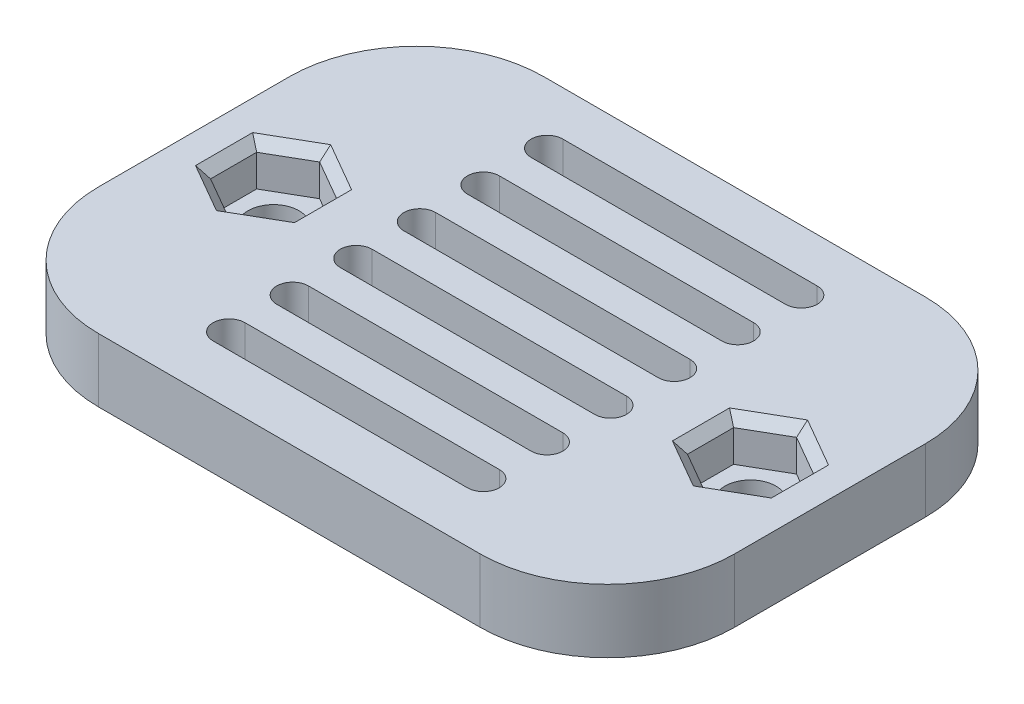
from build123d import *

# Parameters (mm, degrees)
CROQUIS1_W                 = 100
CROQUIS1_H                 = 70
SALIENTE_EXTRUIR1_DEPTH    = 10
CORTAR_EXTRUIR1_DEPTH      = 6.5
CROQUIS5_R                 = 4
CORTAR_EXTRUIR2_DEPTH      = 10
CHAFL_N1_SIZE              = 1.5
CHAFL_N1_OF_SIMETR_A1_SIZE = 1.5
REDONDEO4_R                = 20
REDONDEO5_R                = 20
REDONDEO6_R                = 20
REDONDEO7_R                = 20
CORTAR_EXTRUIR3_DEPTH      = 10


with BuildPart() as part:
    # Croquis1 → Saliente-Extruir1 (new body)
    with BuildSketch(Plane(origin=(0, 0, 0), x_dir=(1, 0, 0), z_dir=(0, 1, 0))):
        with Locations((50, 35)):
            Rectangle(CROQUIS1_W, CROQUIS1_H)
    extrude(amount=SALIENTE_EXTRUIR1_DEPTH)

    # Croquis2 → Cortar-Extruir1 (cut)
    with BuildSketch(Plane(origin=(0, 10, 0), x_dir=(1, 0, 0), z_dir=(0, 1, 0))):
        Polygon((12.5, 42.25), (6.221315823, 38.625), (6.221315823, 31.375), (12.5, 27.75), (18.778684177, 31.375), (18.778684177, 38.625), align=None)
    cortar_extruir1 = extrude(amount=-CORTAR_EXTRUIR1_DEPTH, mode=Mode.SUBTRACT)

    # Croquis5 → Cortar-Extruir2 (cut)
    with BuildSketch(Plane(origin=(0, 10, 0), x_dir=(1, 0, 0), z_dir=(0, 1, 0))):
        with Locations(Location((12.5, 35, 0), (0, 0, 270))):
            Circle(CROQUIS5_R)
    cortar_extruir2 = extrude(amount=-CORTAR_EXTRUIR2_DEPTH, mode=Mode.SUBTRACT)

    # Chaflán1
    chafl_n1_edges = [part.edges().sort_by_distance(p)[0] for p in [
        (15.639342089, 10, -40.4375),
        (9.360657911, 10, -40.4375),
        (6.221315823, 10, -35),
        (9.360657911, 10, -29.5625),
        (15.639342089, 10, -29.5625),
        (18.778684177, 10, -35),
    ]]
    chamfer(chafl_n1_edges, length=CHAFL_N1_SIZE)

    # Simetría1: Cortar-Extruir1, Cortar-Extruir2 across plane
    add(cortar_extruir1.mirror(Plane.ZY.offset(-50)), mode=Mode.SUBTRACT)
    add(cortar_extruir2.mirror(Plane.ZY.offset(-50)), mode=Mode.SUBTRACT)

    # Chaflán1 of Simetría1
    chafl_n1_of_simetr_a1_edges = [part.edges().sort_by_distance(p)[0] for p in [
        (84.360657911, 10, -40.4375),
        (90.639342089, 10, -40.4375),
        (93.778684177, 10, -35),
        (90.639342089, 10, -29.5625),
        (84.360657911, 10, -29.5625),
        (81.221315823, 10, -35),
    ]]
    chamfer(chafl_n1_of_simetr_a1_edges, length=CHAFL_N1_OF_SIMETR_A1_SIZE)

    # Redondeo4
    redondeo4_edges = [part.edges().sort_by_distance(p)[0] for p in [
        (100, 5, -70),
    ]]
    fillet(redondeo4_edges, radius=REDONDEO4_R)

    # Redondeo5
    redondeo5_edges = [part.edges().sort_by_distance(p)[0] for p in [
        (100, 5, 0),
    ]]
    fillet(redondeo5_edges, radius=REDONDEO5_R)

    # Redondeo6
    redondeo6_edges = [part.edges().sort_by_distance(p)[0] for p in [
        (0, 5, 0),
    ]]
    fillet(redondeo6_edges, radius=REDONDEO6_R)

    # Redondeo7
    redondeo7_edges = [part.edges().sort_by_distance(p)[0] for p in [
        (0, 5, -70),
    ]]
    fillet(redondeo7_edges, radius=REDONDEO7_R)

    # Croquis7 → Cortar-Extruir3 (cut)
    with BuildSketch(Plane(origin=(0, 10, 0), x_dir=(1, 0, 0), z_dir=(0, 1, 0))):
        with BuildLine():
            Line((30, 13), (70, 13))
            ThreePointArc((70, 13), (72.5, 10.5), (70, 8))
            Line((70, 8), (30, 8))
            ThreePointArc((30, 8), (27.5, 10.5), (30, 13))
        make_face()
        with BuildLine():
            Line((30, 18), (70, 18))
            ThreePointArc((70, 18), (72.5, 20.5), (70, 23))
            Line((70, 23), (30, 23))
            ThreePointArc((30, 23), (27.5, 20.5), (30, 18))
        make_face()
        with BuildLine():
            Line((30, 28), (70, 28))
            ThreePointArc((70, 28), (72.5, 30.5), (70, 33))
            Line((70, 33), (30, 33))
            ThreePointArc((30, 33), (27.5, 30.5), (30, 28))
        make_face()
        with BuildLine():
            Line((30, 38), (70, 38))
            ThreePointArc((70, 38), (72.5, 40.5), (70, 43))
            Line((70, 43), (30, 43))
            ThreePointArc((30, 43), (27.5, 40.5), (30, 38))
        make_face()
        with BuildLine():
            Line((30, 48), (70, 48))
            ThreePointArc((70, 48), (72.5, 50.5), (70, 53))
            Line((70, 53), (30, 53))
            ThreePointArc((30, 53), (27.5, 50.5), (30, 48))
        make_face()
        with BuildLine():
            Line((30, 58), (70, 58))
            ThreePointArc((70, 58), (72.5, 60.5), (70, 63))
            Line((70, 63), (30, 63))
            ThreePointArc((30, 63), (27.5, 60.5), (30, 58))
        make_face()
    extrude(amount=-CORTAR_EXTRUIR3_DEPTH, mode=Mode.SUBTRACT)


solid = part.part
